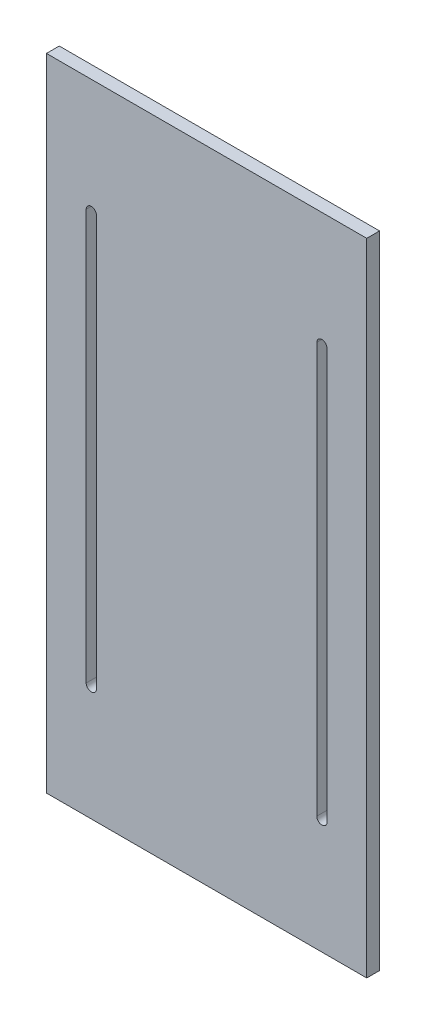
from build123d import *

# Parameters (mm, degrees)
SKETCH1_W            = 50
SKETCH1_H            = 100
BOSS_EXTRUDE1_DEPTH  = 2
CUT_EXTRUDE1_DEPTH   = 56.937465084
LPATTERN1_COUNT      = 2
LPATTERN1_PITCH      = 36
MIRROR1_COPY_1_DEPTH = 56.937465084


with BuildPart() as part:
    # Sketch1 → Boss-Extrude1 (new body)
    with BuildSketch(Plane.XY):
        Rectangle(SKETCH1_W, SKETCH1_H)
    extrude(amount=BOSS_EXTRUDE1_DEPTH)

    # Sketch2 → Cut-Extrude1 (cut, through all)
    with BuildSketch(Plane(origin=(0, 0, 0), x_dir=(-1, 0, 0), z_dir=(0, 0, -1))):
        with BuildLine():
            Line((-18.8, 0), (-17.2, 0))
            Line((-17.2, 0), (-17.2, 32.021950636))
            ThreePointArc((-17.2, 32.021950636), (-18, 32.821950636), (-18.8, 32.021950636))
            Line((-18.8, 32.021950636), (-18.8, 0))
        make_face()
    cut_extrude1 = extrude(amount=-CUT_EXTRUDE1_DEPTH, mode=Mode.SUBTRACT)

    # LPattern1: Cut-Extrude1 ×2
    with Locations(*[(-i * LPATTERN1_PITCH, 0, 0) for i in range(1, LPATTERN1_COUNT)]):
        add(cut_extrude1, mode=Mode.SUBTRACT)

    # Mirror1: Cut-Extrude1 across plane
    add(cut_extrude1.mirror(Plane.ZX), mode=Mode.SUBTRACT)

    # Mirror1 copy 1 sketch → Mirror1 copy 1 (cut, through all)
    with BuildSketch(Plane(origin=(-36, 0, 0), x_dir=(-1, 0, 0), z_dir=(0, 0, -1))):
        with BuildLine():
            Line((-18.8, 0), (-17.2, 0))
            Line((-17.2, 0), (-17.2, -32.021950636))
            ThreePointArc((-17.2, -32.021950636), (-18, -32.821950636), (-18.8, -32.021950636))
            Line((-18.8, -32.021950636), (-18.8, 0))
        make_face()
    extrude(amount=-MIRROR1_COPY_1_DEPTH, mode=Mode.SUBTRACT)


solid = part.part
